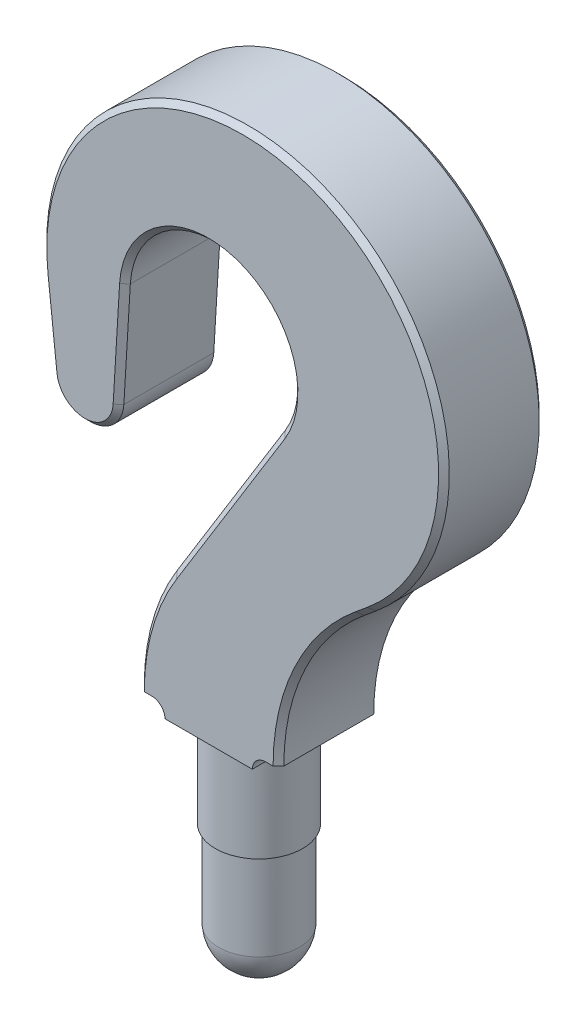
from build123d import *

# Parameters (mm, degrees)
BOSS_EXTRUDE1_DEPTH = 15
CHAMFER1_SIZE       = 0.8
SKETCH2_R           = 6.5
BOSS_EXTRUDE2_DEPTH = 14
SKETCH3_R           = 6
BOSS_EXTRUDE3_DEPTH = 13
DOME1_FACE_RADIUS   = 6
DOME1_HEIGHT        = 5.61


with BuildPart() as part:
    # Sketch1 → Boss-Extrude1 (new body)
    with BuildSketch(Plane.XY):
        with BuildLine():
            Line((5.33, -50.05), (3.429374902, -50.05))
            ThreePointArc((3.429374902, -50.05), (2.032950898, -50.618217894), (1.43, -52))
            Line((1.43, -52), (-11.57, -52))
            ThreePointArc((-11.57, -52), (-12.172950898, -50.618217894), (-13.569374902, -50.05))
            Line((-13.569374902, -50.05), (-15.47, -50.05))
            ThreePointArc((-15.47, -50.05), (-14.21947106, -41.051606397), (-10.562661368, -32.73519774))
            Line((-10.562661368, -32.73519774), (5.571159609, -6.55863722))
            ThreePointArc((5.571159609, -6.55863722), (-1.303288682, 11.918971677), (-17.547628929, 0.747513411))
            Line((-17.547628929, 0.747513411), (-18.508948428, -15.299005365))
            ThreePointArc((-18.508948428, -15.299005365), (-23.375545829, -19.998450876), (-28.469986749, -15.547020759))
            Line((-28.469986749, -15.547020759), (-29.819920496, -3.282124556))
            ThreePointArc((-29.819920496, -3.282124556), (11.287126383, 27.795697113), (19.089371058, -23.142945202))
            Line((19.089371058, -23.142945202), (17.331691836, -24.592760278))
            ThreePointArc((17.331691836, -24.592760278), (8.480844489, -35.977760828), (5.33, -50.05))
        make_face()
    extrude(amount=BOSS_EXTRUDE1_DEPTH)

    # Chamfer1
    chamfer1_edges = [part.edges().sort_by_distance(p)[0] for p in [
        (11.287126383, 27.795697113, 15),
        (-29.144953623, -9.414572658, 15),
        (-14.21947106, -41.051606397, 0),
        (-2.495750879, -19.64691748, 0),
        (-1.303288682, 11.918971677, 0),
        (-18.028288679, -7.275745977, 0),
        (-23.375545829, -19.998450876, 15),
        (-23.375545829, -19.998450876, 0),
        (-29.144953623, -9.414572658, 0),
        (11.287126383, 27.795697113, 0),
        (18.210531447, -23.86785274, 0),
        (8.480844489, -35.977760828, 0),
        (-18.028288679, -7.275745977, 15),
        (-1.303288682, 11.918971677, 15),
        (-2.495750879, -19.64691748, 15),
        (-14.21947106, -41.051606397, 15),
        (8.480844489, -35.977760828, 15),
        (18.210531447, -23.86785274, 15),
    ]]
    chamfer(chamfer1_edges, length=CHAMFER1_SIZE)

    # Sketch2 → Boss-Extrude2 (add)
    with BuildSketch(Plane.XZ.offset(52)):
        with Locations(Location((-5.07, 7.5, 0), (0, 0, 180))):
            Circle(SKETCH2_R)
    extrude(amount=BOSS_EXTRUDE2_DEPTH)

    # Sketch3 → Boss-Extrude3 (add)
    with BuildSketch(Plane.XZ.offset(66)):
        with Locations(Location((-5.07, 7.5, 0), (0, 0, 90))):
            Circle(SKETCH3_R)
    extrude(amount=BOSS_EXTRUDE3_DEPTH)

    # Dome1: a dome of height H over a round flat face of radius A is a cap of a sphere of radius (A * A + H * H) / (2 * H)
    dome1_r = (DOME1_FACE_RADIUS * DOME1_FACE_RADIUS + DOME1_HEIGHT * DOME1_HEIGHT) / (2 * DOME1_HEIGHT)
    dome1_base = Plane((-5.07, -79, 7.5), z_dir=(0, -1, 0))
    with Locations(dome1_base.offset(DOME1_HEIGHT - dome1_r)):
        dome1_ball = Sphere(dome1_r, mode=Mode.PRIVATE)
    add(split(dome1_ball, bisect_by=dome1_base, keep=Keep.TOP, mode=Mode.PRIVATE))


solid = part.part
